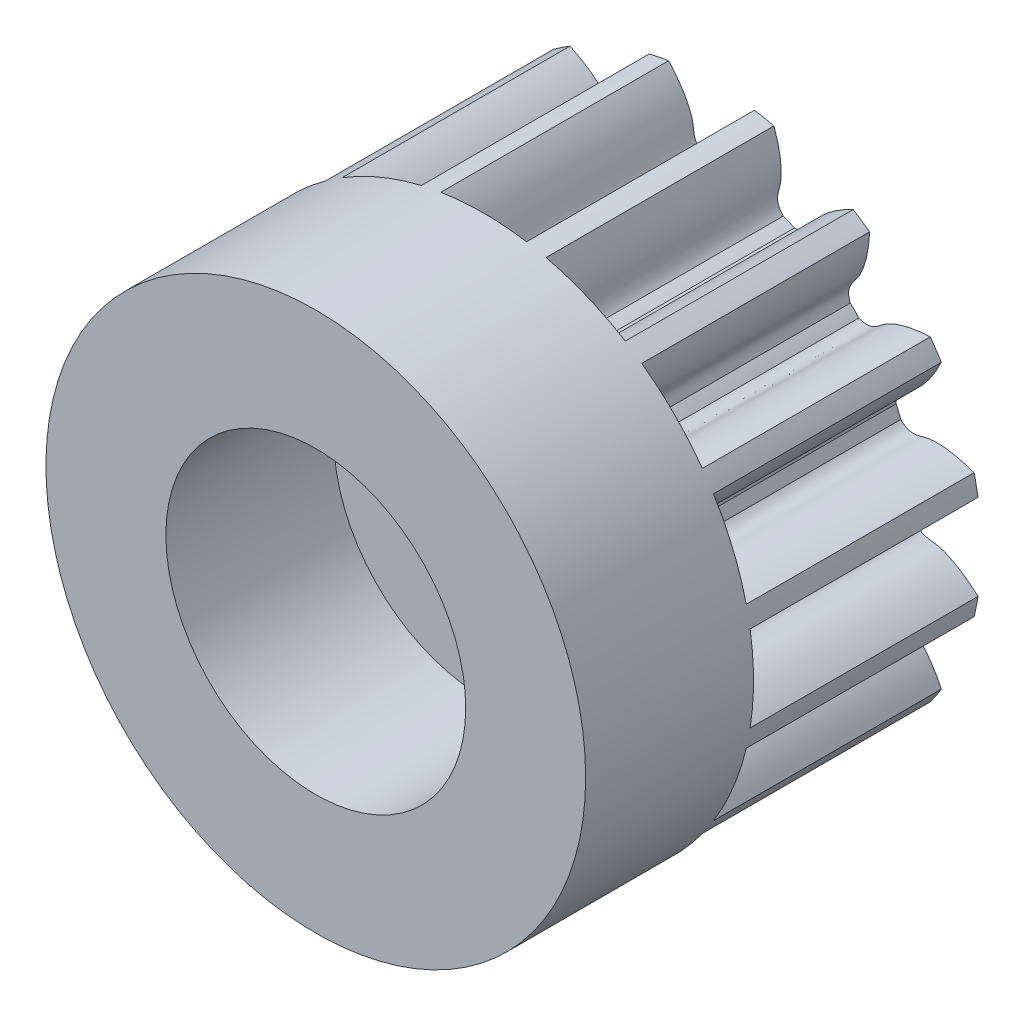
from build123d import *

# Parameters (mm, degrees)
SKETCH_1_R               = 4.5
EXTRUDE_1_DEPTH          = 3.8
CUT_EXTRUDE_1_DEPTH      = 8.412152184
PATTERN_CIRCULAR_1_COUNT = 16
SKETCH_4_R               = 4.5
SKETCH_4_R_2             = 2.5
EXTRUDE_2_DEPTH          = 2.8


with BuildPart() as part:
    # 草图1 → 凸台-拉伸1 (new body)
    with BuildSketch(Plane.XY):
        Circle(SKETCH_1_R)
    extrude(amount=EXTRUDE_1_DEPTH)

    # 草图2 → 切除-拉伸1 (cut, through all)
    with BuildSketch(Plane.XY):
        with BuildLine():
            ThreePointArc((0.101680395, 3.373467963), (0, 3.375), (-0.101680395, 3.373467963))
            add(Edge.make_bspline(
                [(-0.101680395, 3.373467963), (-0.320919735, 3.465061005), (-0.284660598, 3.635349809), (-0.322390644, 3.793404963), (-0.325601394, 3.80577545), (-0.329466049, 3.819526781), (-0.334039479, 3.834637453), (-0.339377888, 3.851083952), (-0.345536205, 3.868841182), (-0.352568839, 3.887882349), (-0.360529384, 3.908179024), (-0.369470654, 3.92970115), (-0.379444617, 3.952417062), (-0.390502356, 3.976293514), (-0.402694025, 4.001295699), (-0.416068812, 4.02738727), (-0.430674889, 4.054530373), (-0.446559381, 4.082685666), (-0.463768319, 4.111812348), (-0.482346604, 4.141868189), (-0.502337967, 4.172809557), (-0.523784931, 4.20459145), (-0.546728776, 4.237167525), (-0.571209498, 4.270490132), (-0.597265778, 4.304510345), (-0.624934946, 4.339177997), (-0.654252942, 4.374441713), (-0.685254293, 4.41024895), (-0.717972069, 4.446546028), (-0.752437861, 4.483278171), (-0.788681746, 4.520389541), (-0.826732258, 4.557823283), (-0.866616358, 4.595521557), (-0.90835941, 4.633425586), (-0.951985152, 4.67147569), (-0.99751567, 4.709611333), (-1.044971373, 4.747771162), (-1.094370973, 4.785893051), (-1.145731456, 4.823914147), (-1.199068069, 4.861770908), (-1.254394289, 4.899399156), (-1.311721817, 4.936734114), (-1.371060539, 4.97371046), (-1.453732402, 5.022959339), (-1.517494148, 5.058370721), (-1.560889991, 5.081371225)],
                knots=[0, 0, 0, 0, 0.200958108, 0.205848205, 0.211390316, 0.217584439, 0.224430575, 0.231928724, 0.240078886, 0.248881062, 0.25833525, 0.268441451, 0.279199665, 0.290609892, 0.302672132, 0.315386384, 0.32875265, 0.342770929, 0.357441221, 0.372763526, 0.388737843, 0.405364174, 0.422642518, 0.440572874, 0.459155244, 0.478389626, 0.498276022, 0.51881443, 0.540004852, 0.561847286, 0.584341734, 0.607488194, 0.631286667, 0.655737153, 0.680839653, 0.706594165, 0.73300069, 0.760059228, 0.787769779, 0.816132343, 0.84514692, 0.87481351, 0.905132113, 0.936102729, 1, 1, 1, 1], degree=3))
            ThreePointArc((-1.560889991, 5.081371225), (0, 5.315704195), (1.560889991, 5.081371225))
            add(Edge.make_bspline(
                [(0.101680395, 3.373467963), (0.320919735, 3.465061005), (0.284660598, 3.635349809), (0.322390644, 3.793404963), (0.325601394, 3.80577545), (0.329466049, 3.819526781), (0.334039479, 3.834637453), (0.339377888, 3.851083952), (0.345536205, 3.868841182), (0.352568839, 3.887882349), (0.360529384, 3.908179024), (0.369470654, 3.92970115), (0.379444617, 3.952417062), (0.390502356, 3.976293514), (0.402694025, 4.001295699), (0.416068812, 4.02738727), (0.430674889, 4.054530373), (0.446559381, 4.082685666), (0.463768319, 4.111812348), (0.482346604, 4.141868189), (0.502337967, 4.172809557), (0.523784931, 4.20459145), (0.546728776, 4.237167525), (0.571209498, 4.270490132), (0.597265778, 4.304510345), (0.624934946, 4.339177997), (0.654252942, 4.374441713), (0.685254293, 4.41024895), (0.717972069, 4.446546028), (0.752437861, 4.483278171), (0.788681746, 4.520389541), (0.826732258, 4.557823283), (0.866616358, 4.595521557), (0.90835941, 4.633425586), (0.951985152, 4.67147569), (0.99751567, 4.709611333), (1.044971373, 4.747771162), (1.094370973, 4.785893051), (1.145731456, 4.823914147), (1.199068069, 4.861770908), (1.254394289, 4.899399156), (1.311721817, 4.936734114), (1.371060539, 4.97371046), (1.453732402, 5.022959339), (1.517494148, 5.058370721), (1.560889991, 5.081371225)],
                knots=[0, 0, 0, 0, 0.200958108, 0.205848205, 0.211390316, 0.217584439, 0.224430575, 0.231928724, 0.240078886, 0.248881062, 0.25833525, 0.268441451, 0.279199665, 0.290609892, 0.302672132, 0.315386384, 0.32875265, 0.342770929, 0.357441221, 0.372763526, 0.388737843, 0.405364174, 0.422642518, 0.440572874, 0.459155244, 0.478389626, 0.498276022, 0.51881443, 0.540004852, 0.561847286, 0.584341734, 0.607488194, 0.631286667, 0.655737153, 0.680839653, 0.706594165, 0.73300069, 0.760059228, 0.787769779, 0.816132343, 0.84514692, 0.87481351, 0.905132113, 0.936102729, 1, 1, 1, 1], degree=3))
        make_face()
    cut_extrude_1 = extrude(amount=CUT_EXTRUDE_1_DEPTH, mode=Mode.SUBTRACT)

    # 阵列(圆周)1: 切除-拉伸1 ×16 about axis
    pattern_circular_1_axis = Axis((0, 0, 3.8), (0, 0, -1))
    for i in range(1, PATTERN_CIRCULAR_1_COUNT):
        add(cut_extrude_1.rotate(pattern_circular_1_axis, i * 360 / PATTERN_CIRCULAR_1_COUNT), mode=Mode.SUBTRACT)

    # 草图4 → 凸台-拉伸2 (add)
    with BuildSketch(Plane.XY.offset(3.8)):
        Circle(SKETCH_4_R)
        Circle(SKETCH_4_R_2, mode=Mode.SUBTRACT)
    extrude(amount=EXTRUDE_2_DEPTH)


solid = part.part
